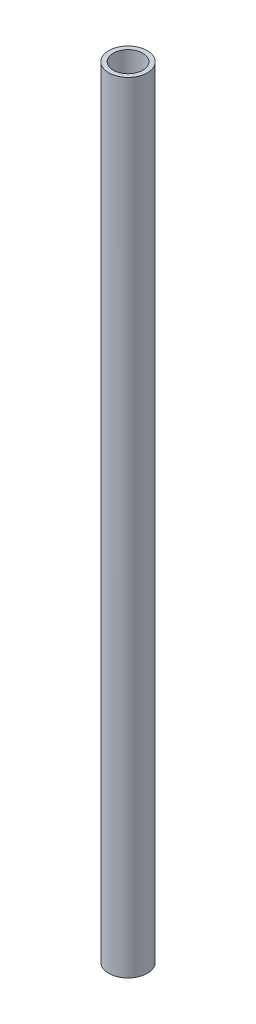
from build123d import *

# Parameters (mm, degrees)
BOSS_EXTRUDE1_START = -128.579996
SKETCH1_R           = 6.35
SKETCH1_R_2         = 4.8768
BOSS_EXTRUDE1_DEPTH = 257.159992


with BuildPart() as part:
    # Sketch1 → Boss-Extrude1 (new body)
    with BuildSketch(Plane(origin=(0, 0, 0), x_dir=(1, 0, 0), z_dir=(0, 1, 0)).offset(BOSS_EXTRUDE1_START)):
        with Locations(Location((0, 0, 0), (0, 0, 90))):
            Circle(SKETCH1_R)
        with Locations(Location((0, 0, 0), (0, 0, 306.096724158))):
            Circle(SKETCH1_R_2, mode=Mode.SUBTRACT)
    extrude(amount=BOSS_EXTRUDE1_DEPTH)


solid = part.part
